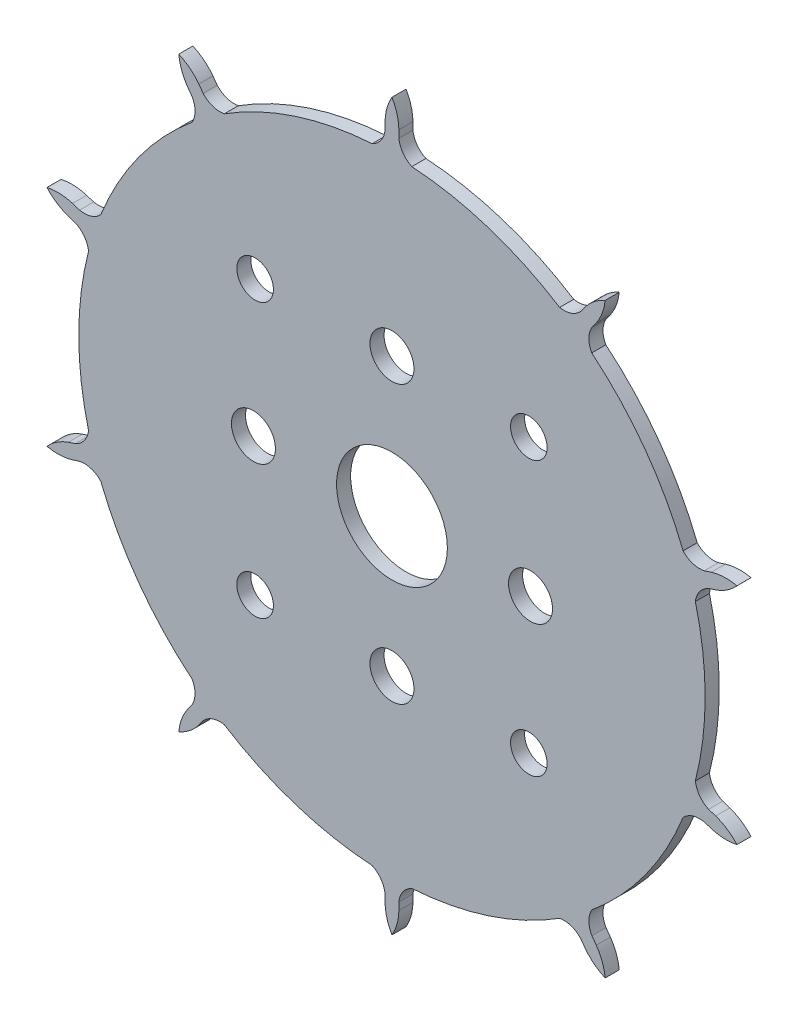
from build123d import *

# Parameters (mm, degrees)
SKETCH1_R           = 22.6042
SKETCH1_R_2         = 1.5875
SKETCH1_R_3         = 1.3208
SKETCH1_R_4         = 4
BOSS_EXTRUDE2_DEPTH = 1.016
BOSS_EXTRUDE4_DEPTH = 1.016
CIRPATTERN1_COUNT   = 10


with BuildPart() as part:
    # Sketch1 → Boss-Extrude2 (new body)
    with BuildSketch(Plane.XY):
        Circle(SKETCH1_R)
        with Locations((0, 10)):
            Circle(SKETCH1_R_2, mode=Mode.SUBTRACT)
        with Locations((9.878281733, -9.878281733)):
            Circle(SKETCH1_R_3, mode=Mode.SUBTRACT)
        with Locations((9.878281733, 9.878281733)):
            Circle(SKETCH1_R_3, mode=Mode.SUBTRACT)
        with Locations((-9.878281733, -9.878281733)):
            Circle(SKETCH1_R_3, mode=Mode.SUBTRACT)
        with Locations((-9.878281733, 9.878281733)):
            Circle(SKETCH1_R_3, mode=Mode.SUBTRACT)
        Circle(SKETCH1_R_4, mode=Mode.SUBTRACT)
        with Locations((10, 0)):
            Circle(SKETCH1_R_2, mode=Mode.SUBTRACT)
        with Locations((0, -10)):
            Circle(SKETCH1_R_2, mode=Mode.SUBTRACT)
        with Locations((-10, 0)):
            Circle(SKETCH1_R_2, mode=Mode.SUBTRACT)
    extrude(amount=BOSS_EXTRUDE2_DEPTH)

    # Sketch2 → Boss-Extrude4 (add)
    with BuildSketch(Plane.XY.offset(1.016)):
        with BuildLine():
            Line((-0.499962578, 23.867964213), (-0.499962578, 24.401364213))
            ThreePointArc((-0.499962578, 24.401364213), (-0.363993462, 25.322423729), (0, 26.179364213))
            ThreePointArc((0, 26.179364213), (0.363993462, 25.322423729), (0.499962578, 24.401364213))
            Line((0.499962578, 24.401364213), (0.499962578, 23.867964213))
            ThreePointArc((0.499962578, 23.867964213), (0.860362618, 23.002073844), (1.639119464, 22.479396033))
            ThreePointArc((1.639119464, 22.479396033), (0, 22.249732232), (-1.639119464, 22.479396033))
            ThreePointArc((-1.639119464, 22.479396033), (-0.860362618, 23.002073844), (-0.499962578, 23.867964213))
        make_face()
    boss_extrude4 = extrude(amount=-BOSS_EXTRUDE4_DEPTH)

    # CirPattern1: Boss-Extrude4 ×10 about axis
    cirpattern1_axis = Axis((0, 0, 0), (0, 0, 1))
    for i in range(1, CIRPATTERN1_COUNT):
        add(boss_extrude4.rotate(cirpattern1_axis, i * 360 / CIRPATTERN1_COUNT))


solid = part.part
